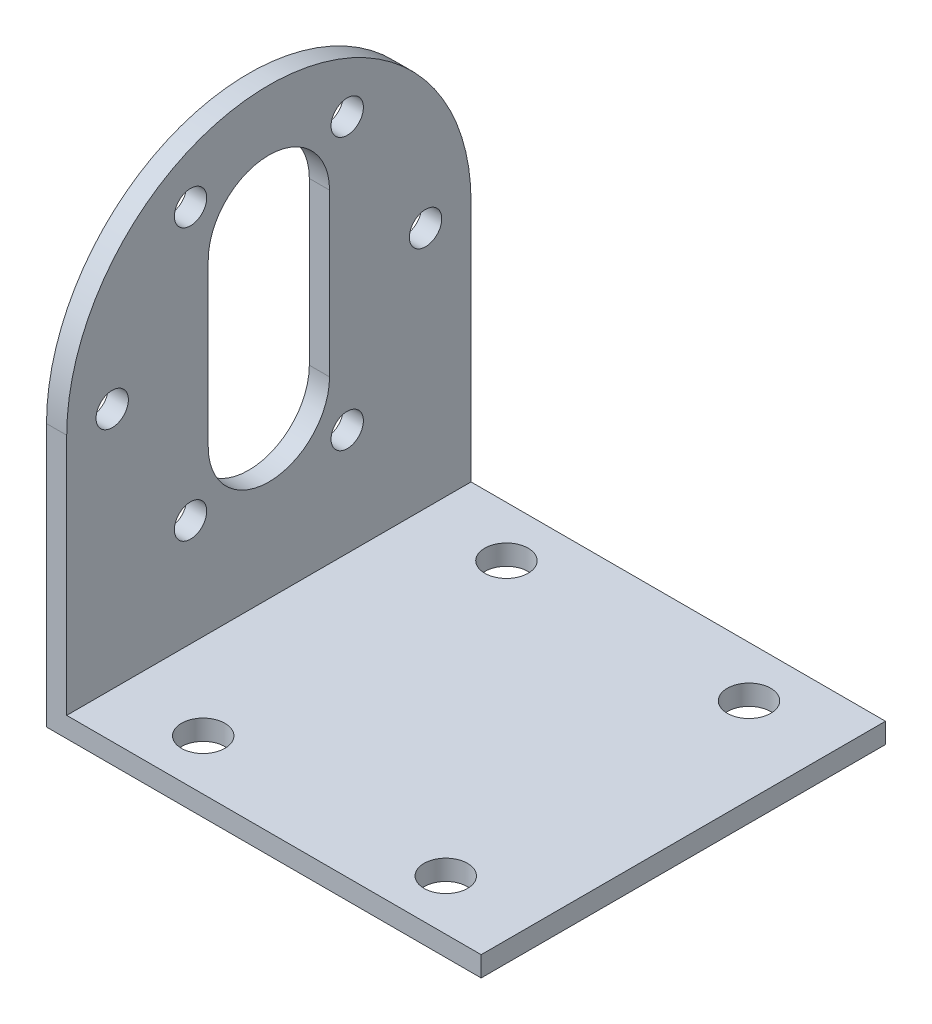
from build123d import *

# Parameters (mm, degrees)
SKETCH_1_W      = 43
SKETCH_1_H      = 40
SKETCH_1_R      = 2.15
EXTRUDE_1_DEPTH = 2
SKETCH_3_R      = 1.6
EXTRUDE_2_DEPTH = 2


with BuildPart() as part:
    # 草图1 → 凸台-拉伸1 (new body)
    with BuildSketch(Plane(origin=(0, 0, 0), x_dir=(1, 0, 0), z_dir=(0, 1, 0))):
        Rectangle(SKETCH_1_W, SKETCH_1_H)
        with Locations(Location((13, 15, 0), (0, 0, 270))):
            Circle(SKETCH_1_R, mode=Mode.SUBTRACT)
        with Locations(Location((13, -15, 0), (0, 0, 90))):
            Circle(SKETCH_1_R, mode=Mode.SUBTRACT)
        with Locations(Location((-11, 15, 0), (0, 0, 90))):
            Circle(SKETCH_1_R, mode=Mode.SUBTRACT)
        with Locations(Location((-11, -15, 0), (0, 0, 270))):
            Circle(SKETCH_1_R, mode=Mode.SUBTRACT)
    extrude(amount=EXTRUDE_1_DEPTH)

    # 草图3 → 凸台-拉伸2 (add)
    with BuildSketch(Plane.ZY.offset(21.5)):
        with BuildLine():
            Line((-20, 0), (-20, 26))
            ThreePointArc((-20, 26), (0, 46), (20, 26))
            Line((20, 26), (20, 0))
            Line((20, 0), (-20, 0))
        make_face()
        with Locations((-15.5, 26)):
            Circle(SKETCH_3_R, mode=Mode.SUBTRACT)
        with Locations((-7.75, 39.423393759)):
            Circle(SKETCH_3_R, mode=Mode.SUBTRACT)
        with Locations((7.75, 39.423393759)):
            Circle(SKETCH_3_R, mode=Mode.SUBTRACT)
        with Locations((15.5, 26)):
            Circle(SKETCH_3_R, mode=Mode.SUBTRACT)
        with Locations((7.75, 12.576606241)):
            Circle(SKETCH_3_R, mode=Mode.SUBTRACT)
        with Locations((-7.75, 12.576606241)):
            Circle(SKETCH_3_R, mode=Mode.SUBTRACT)
        with BuildLine():
            Line((-6, 18), (-6, 34))
            ThreePointArc((-6, 34), (0, 40), (6, 34))
            Line((6, 34), (6, 18))
            ThreePointArc((6, 18), (0, 12), (-6, 18))
        make_face(mode=Mode.SUBTRACT)
    extrude(amount=-EXTRUDE_2_DEPTH)


solid = part.part
